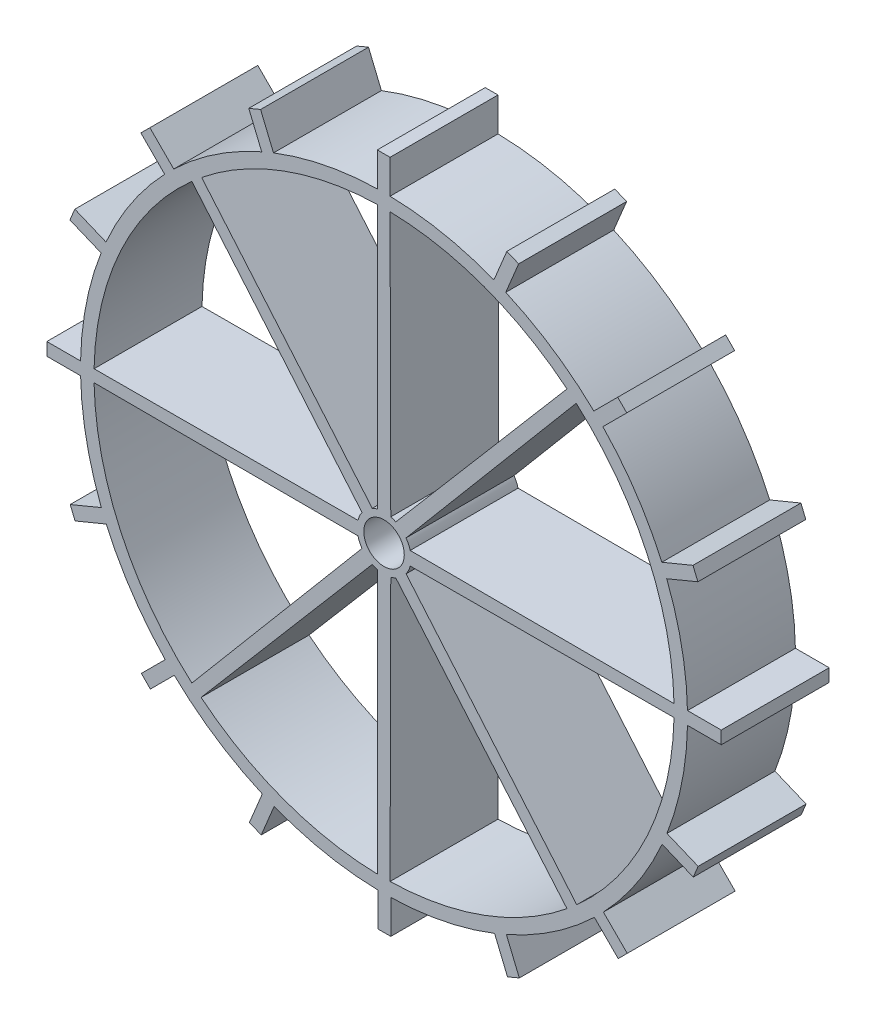
from build123d import *

# Parameters (mm, degrees)
SALIENTE_EXTRUIR1_DEPTH = 40
CROQUIS2_W              = 9.479166667
CROQUIS2_H              = 25
CROQUIS2_W_2            = 25
CROQUIS2_H_2            = 9.479166667
SALIENTE_EXTRUIR2_DEPTH = 80
CROQUIS3_R              = 20
SALIENTE_EXTRUIR3_DEPTH = 80
CROQUIS4_R              = 15
CORTAR_EXTRUIR1_DEPTH   = 80
CROQUIS8_W              = 4
CROQUIS8_H              = 3
SALIENTE_EXTRUIR4_DEPTH = 19
CROQUIS9_R              = 15
CORTAR_EXTRUIR3_DEPTH   = 363.429876335


with BuildPart() as part:
    # Croquis1 → Saliente-Extruir1 (new, symmetric)
    with BuildSketch(Plane.XY):
        with BuildLine():
            ThreePointArc((-224.955926351, -4.453223482), (-159.292265632, -158.90555091), (-5, -224.944437584))
            ThreePointArc((-5, -224.944437584), (72.506901641, -212.997063863), (141.205472177, -175.174240764))
            ThreePointArc((141.205472177, -175.174240764), (145.300285764, -171.79297703), (149.31416044, -168.316016742))
            ThreePointArc((149.31416044, -168.316016742), (204.039526473, -94.83075259), (224.929799791, -5.620068165))
            ThreePointArc((224.929799791, -5.620068165), (224.982449263, -2.810253291), (225, 0))
            ThreePointArc((225, 0), (224.982449263, 2.810253291), (224.929799791, 5.620068165))
            ThreePointArc((224.929799791, 5.620068165), (204.170039134, 94.549432151), (149.777577039, 167.903774277))
            ThreePointArc((149.777577039, 167.903774277), (145.536932266, 171.592544554), (141.205472177, 175.174240764))
            ThreePointArc((141.205472177, 175.174240764), (77.513474556, 211.226563818), (5.620068165, 224.929799791))
            ThreePointArc((5.620068165, 224.929799791), (0.310120458, 224.999786278), (-5, 224.944437584))
            ThreePointArc((-5, 224.944437584), (-77.513474556, 211.226563818), (-141.687825127, 174.784324843))
            ThreePointArc((-141.687825127, 174.784324843), (-202.138767057, 98.817603962), (-224.955926351, 4.453223482))
            ThreePointArc((-224.955926351, 4.453223482), (-225, 0), (-224.955926351, -4.453223482))
        make_face()
        with BuildLine():
            ThreePointArc((-5, -214.941852602), (-74.312911497, -201.748831929), (-135.622478375, -166.827885437))
            Line((-135.622478375, -166.827885437), (-5.334401385, -14.019420882))
            ThreePointArc((-5.334401385, -14.019420882), (-5.16756497, -14.081770921), (-5, -14.142135624))
            Line((-5, -14.142135624), (-5, -214.941852602))
        make_face(mode=Mode.SUBTRACT)
        with BuildLine():
            Line((-12.960736698, -7.551112781), (-142.45440376, -161.033359431))
            ThreePointArc((-142.45440376, -161.033359431), (-195.095815172, -90.347235166), (-214.95333695, -4.479166667))
            Line((-214.95333695, -4.479166667), (-14.142135624, -5))
            ThreePointArc((-14.142135624, -5), (-13.611335942, -6.303295477), (-12.960736698, -7.551112781))
        make_face(mode=Mode.SUBTRACT)
        with BuildLine():
            ThreePointArc((135.622478375, -166.827885437), (74.068431242, -201.838716537), (4.479166667, -214.95333695))
            Line((4.479166667, -214.95333695), (5, -14.142135624))
            ThreePointArc((5, -14.142135624), (5.16756497, -14.081770921), (5.334401385, -14.019420882))
            Line((5.334401385, -14.019420882), (135.622478375, -166.827885437))
        make_face(mode=Mode.SUBTRACT)
        with BuildLine():
            Line((142.844180294, -160.687710035), (12.960736698, -7.551112781))
            ThreePointArc((12.960736698, -7.551112781), (13.611335942, -6.303295477), (14.142135624, -5))
            Line((14.142135624, -5), (214.95333695, -4.479166667))
            ThreePointArc((214.95333695, -4.479166667), (195.205130803, -90.110803505), (142.844180294, -160.687710035))
        make_face(mode=Mode.SUBTRACT)
        with BuildLine():
            ThreePointArc((-214.95333695, 4.479166667), (-195.095815172, 90.347235166), (-142.45440376, 161.033359431))
            Line((-142.45440376, 161.033359431), (-12.960736698, 7.551112781))
            ThreePointArc((-12.960736698, 7.551112781), (-13.611335942, 6.303295477), (-14.142135624, 5))
            Line((-14.142135624, 5), (-214.95333695, 4.479166667))
        make_face(mode=Mode.SUBTRACT)
        with BuildLine():
            Line((-5.334401385, 14.019420882), (-135.21784498, 167.156018135))
            ThreePointArc((-135.21784498, 167.156018135), (-74.068431242, 201.838716537), (-5, 214.941852602))
            Line((-5, 214.941852602), (-5, 14.142135624))
            ThreePointArc((-5, 14.142135624), (-5.16756497, 14.081770921), (-5.334401385, 14.019420882))
        make_face(mode=Mode.SUBTRACT)
        with BuildLine():
            Line((214.95333695, 4.479166667), (14.142135624, 5))
            ThreePointArc((14.142135624, 5), (13.611335942, 6.303295477), (12.960736698, 7.551112781))
            Line((12.960736698, 7.551112781), (142.45440376, 161.033359431))
            ThreePointArc((142.45440376, 161.033359431), (195.095815172, 90.347235166), (214.95333695, 4.479166667))
        make_face(mode=Mode.SUBTRACT)
        with BuildLine():
            ThreePointArc((5.334401385, 14.019420882), (5.16756497, 14.081770921), (5, 14.142135624))
            Line((5, 14.142135624), (4.479166667, 214.95333695))
            ThreePointArc((4.479166667, 214.95333695), (74.068431242, 201.838716537), (135.622478375, 166.827885437))
            Line((135.622478375, 166.827885437), (5.334401385, 14.019420882))
        make_face(mode=Mode.SUBTRACT)
    extrude(amount=SALIENTE_EXTRUIR1_DEPTH, both=True)

    # Croquis2 → Saliente-Extruir2 (add)
    with BuildSketch(Plane.XY.offset(40)):
        Polygon((90.224919325, 206.117597339), (99.792005134, 229.214585652), (91.034397066, 232.842105688), (81.467311257, 209.745117375), align=None)
        with Locations((-0.260416666, 237.455411284)):
            Rectangle(CROQUIS2_W, CROQUIS2_H)
        Polygon((162.234745908, 155.900247659), (179.912415437, 173.577917189), (173.209632407, 180.280700219), (155.531962878, 162.603030689), align=None)
        Polygon((209.545803087, 81.948498513), (232.6427914, 91.515584322), (229.015271364, 100.273192391), (205.918283051, 90.706106582), align=None)
        with Locations((237.455411284, 0.260416666)):
            Rectangle(CROQUIS2_W_2, CROQUIS2_H_2)
        Polygon((206.117597339, -90.224919325), (229.214585652, -99.792005134), (232.842105688, -91.034397066), (209.745117375, -81.467311257), align=None)
        Polygon((155.90024766, -162.234745908), (173.577917189, -179.912415437), (180.280700219, -173.209632407), (162.603030689, -155.531962878), align=None)
        Polygon((81.948498513, -209.545803087), (91.515584322, -232.6427914), (100.273192391, -229.015271364), (90.706106582, -205.918283051), align=None)
        with Locations((0.260416666, -237.455411284)):
            Rectangle(CROQUIS2_W, CROQUIS2_H)
        Polygon((-90.224919325, -206.117597339), (-99.792005134, -229.214585652), (-91.034397066, -232.842105688), (-81.467311257, -209.745117375), align=None)
        Polygon((-162.234745908, -155.900247659), (-179.912415437, -173.577917189), (-173.209632407, -180.280700219), (-155.531962878, -162.603030689), align=None)
        Polygon((-209.545803087, -81.948498513), (-232.6427914, -91.515584322), (-229.015271364, -100.273192391), (-205.918283051, -90.706106582), align=None)
        with Locations((-237.455411284, -0.260416666)):
            Rectangle(CROQUIS2_W_2, CROQUIS2_H_2)
        Polygon((-206.117597339, 90.224919325), (-229.214585652, 99.792005134), (-232.842105688, 91.034397066), (-209.745117375, 81.467311257), align=None)
        Polygon((-155.900247659, 162.234745908), (-173.577917189, 179.912415437), (-180.280700219, 173.209632407), (-162.603030689, 155.531962878), align=None)
        Polygon((-81.948498513, 209.545803087), (-91.515584322, 232.6427914), (-100.273192391, 229.015271364), (-90.706106582, 205.918283051), align=None)
    extrude(amount=-SALIENTE_EXTRUIR2_DEPTH)

    # Croquis3 → Saliente-Extruir3 (add)
    with BuildSketch(Plane(origin=(0, 0, -40), x_dir=(-1, 0, 0), z_dir=(0, 0, -1))):
        Circle(CROQUIS3_R)
    extrude(amount=-SALIENTE_EXTRUIR3_DEPTH)

    # Croquis4 → Cortar-Extruir1 (cut)
    with BuildSketch(Plane(origin=(0, 0, -40), x_dir=(-1, 0, 0), z_dir=(0, 0, -1))):
        Circle(CROQUIS4_R)
    extrude(amount=-CORTAR_EXTRUIR1_DEPTH, mode=Mode.SUBTRACT)

    # Croquis8 → Saliente-Extruir4 (add)
    with BuildSketch(Plane(origin=(0, 0, -40), x_dir=(-1, 0, 0), z_dir=(0, 0, -1))):
        with Locations((0, 15)):
            Rectangle(CROQUIS8_W, CROQUIS8_H)
    extrude(amount=SALIENTE_EXTRUIR4_DEPTH)

    # Croquis9 → Cortar-Extruir3 (cut, through all)
    with BuildSketch(Plane(origin=(0, 0, -40), x_dir=(-1, 0, 0), z_dir=(0, 0, -1))):
        with Locations(Location((0, 0, 0), (0, 0, 82.337744339))):
            Circle(CROQUIS9_R)
    extrude(amount=CORTAR_EXTRUIR3_DEPTH, mode=Mode.SUBTRACT)


solid = part.part
